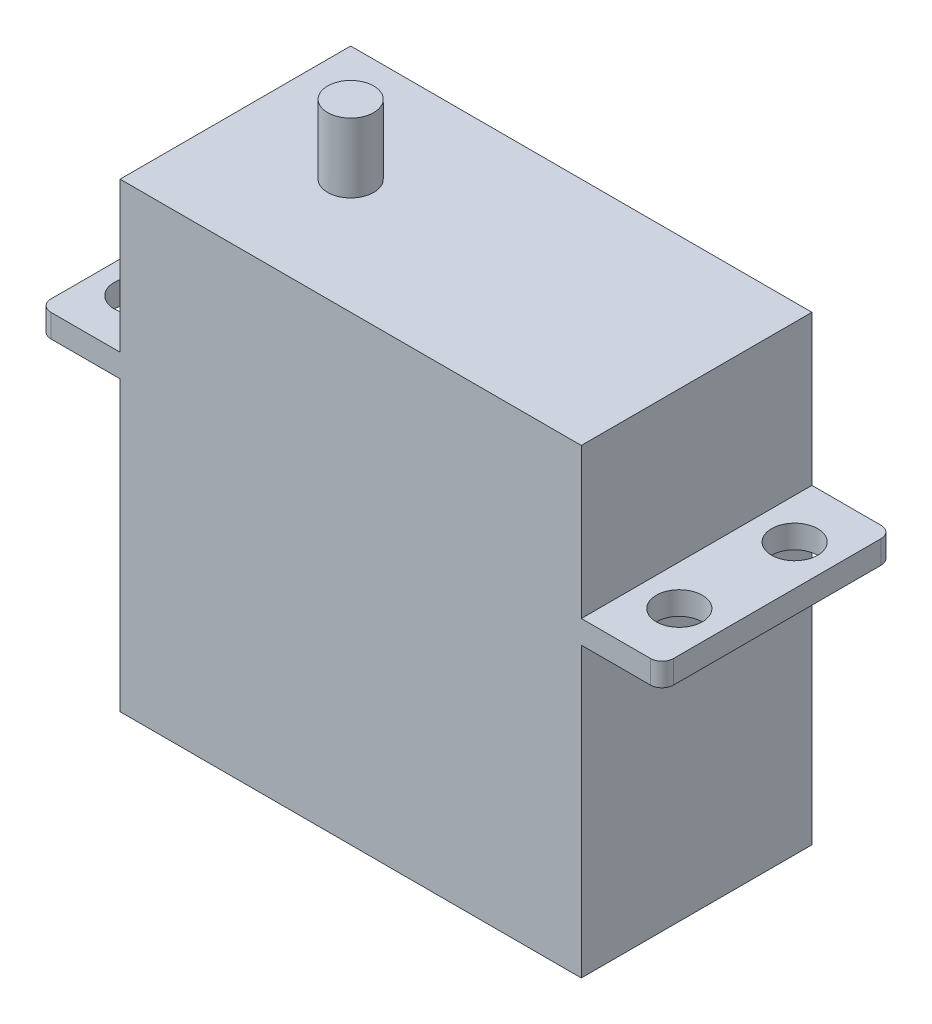
from build123d import *

# Parameters (mm, degrees)
Y_KSEKLIK_EKSTR_ZYON1_DEPTH = 20
RADYUS1_R                   = 1
KES_EKSTR_ZYON1_REACH       = 59.775
IZIM2_R                     = 2
IZIM3_R                     = 2
Y_KSEKLIK_EKSTR_ZYON2_DEPTH = 6


with BuildPart() as part:
    # Çizim1 → Yükseklik-Ekstrüzyon1 (new body)
    with BuildSketch(Plane.XY):
        Polygon((0, 0), (40, 0), (40, 25), (47, 25), (47, 27), (40, 27), (40, 40), (0, 40), (0, 27), (-7, 27), (-7, 25), (0, 25), align=None)
    extrude(amount=Y_KSEKLIK_EKSTR_ZYON1_DEPTH)

    # Radyus1
    radyus1_edges = [part.edges().sort_by_distance(p)[0] for p in [
        (-7, 26, 0),
        (47, 26, 0),
        (47, 26, 20),
        (-7, 26, 20),
    ]]
    fillet(radyus1_edges, radius=RADYUS1_R)

    # Çizim2 → Kes-Ekstrüzyon1 (cut, up to next)
    with BuildSketch(Plane(origin=(0, 27, 0), x_dir=(1, 0, 0), z_dir=(0, 1, 0)), mode=Mode.PRIVATE) as kes_ekstr_zyon1_sk1:
        with Locations(Location((-3.5, -5, 0), (0, 0, 270))):
            Circle(IZIM2_R)
    kes_ekstr_zyon1_tool1 = extrude(kes_ekstr_zyon1_sk1.sketch, amount=-KES_EKSTR_ZYON1_REACH, mode=Mode.PRIVATE) & part.part
    # Çizim2 → Kes-Ekstrüzyon1 (cut, up to next)
    with BuildSketch(Plane(origin=(0, 27, 0), x_dir=(1, 0, 0), z_dir=(0, 1, 0)), mode=Mode.PRIVATE) as kes_ekstr_zyon1_sk2:
        with Locations(Location((-3.5, -15, 0), (0, 0, 270))):
            Circle(IZIM2_R)
    kes_ekstr_zyon1_tool2 = extrude(kes_ekstr_zyon1_sk2.sketch, amount=-KES_EKSTR_ZYON1_REACH, mode=Mode.PRIVATE) & part.part
    # Çizim2 → Kes-Ekstrüzyon1 (cut, up to next)
    with BuildSketch(Plane(origin=(0, 27, 0), x_dir=(1, 0, 0), z_dir=(0, 1, 0)), mode=Mode.PRIVATE) as kes_ekstr_zyon1_sk3:
        with Locations(Location((43.5, -5, 0), (0, 0, 270))):
            Circle(IZIM2_R)
    kes_ekstr_zyon1_tool3 = extrude(kes_ekstr_zyon1_sk3.sketch, amount=-KES_EKSTR_ZYON1_REACH, mode=Mode.PRIVATE) & part.part
    # Çizim2 → Kes-Ekstrüzyon1 (cut, up to next)
    with BuildSketch(Plane(origin=(0, 27, 0), x_dir=(1, 0, 0), z_dir=(0, 1, 0)), mode=Mode.PRIVATE) as kes_ekstr_zyon1_sk4:
        with Locations(Location((43.5, -15, 0), (0, 0, 270))):
            Circle(IZIM2_R)
    kes_ekstr_zyon1_tool4 = extrude(kes_ekstr_zyon1_sk4.sketch, amount=-KES_EKSTR_ZYON1_REACH, mode=Mode.PRIVATE) & part.part
    add(kes_ekstr_zyon1_tool1.solids().sort_by_distance((-3.5, 27, 5))[0], mode=Mode.SUBTRACT)
    add(kes_ekstr_zyon1_tool2.solids().sort_by_distance((-3.5, 27, 15))[0], mode=Mode.SUBTRACT)
    add(kes_ekstr_zyon1_tool3.solids().sort_by_distance((43.5, 27, 5))[0], mode=Mode.SUBTRACT)
    add(kes_ekstr_zyon1_tool4.solids().sort_by_distance((43.5, 27, 15))[0], mode=Mode.SUBTRACT)

    # Çizim3 → Yükseklik-Ekstrüzyon2 (add)
    with BuildSketch(Plane(origin=(0, 40, 0), x_dir=(1, 0, 0), z_dir=(0, 1, 0))):
        with Locations(Location((10, -10, 0), (0, 0, 90))):
            Circle(IZIM3_R)
    extrude(amount=Y_KSEKLIK_EKSTR_ZYON2_DEPTH)


solid = part.part
